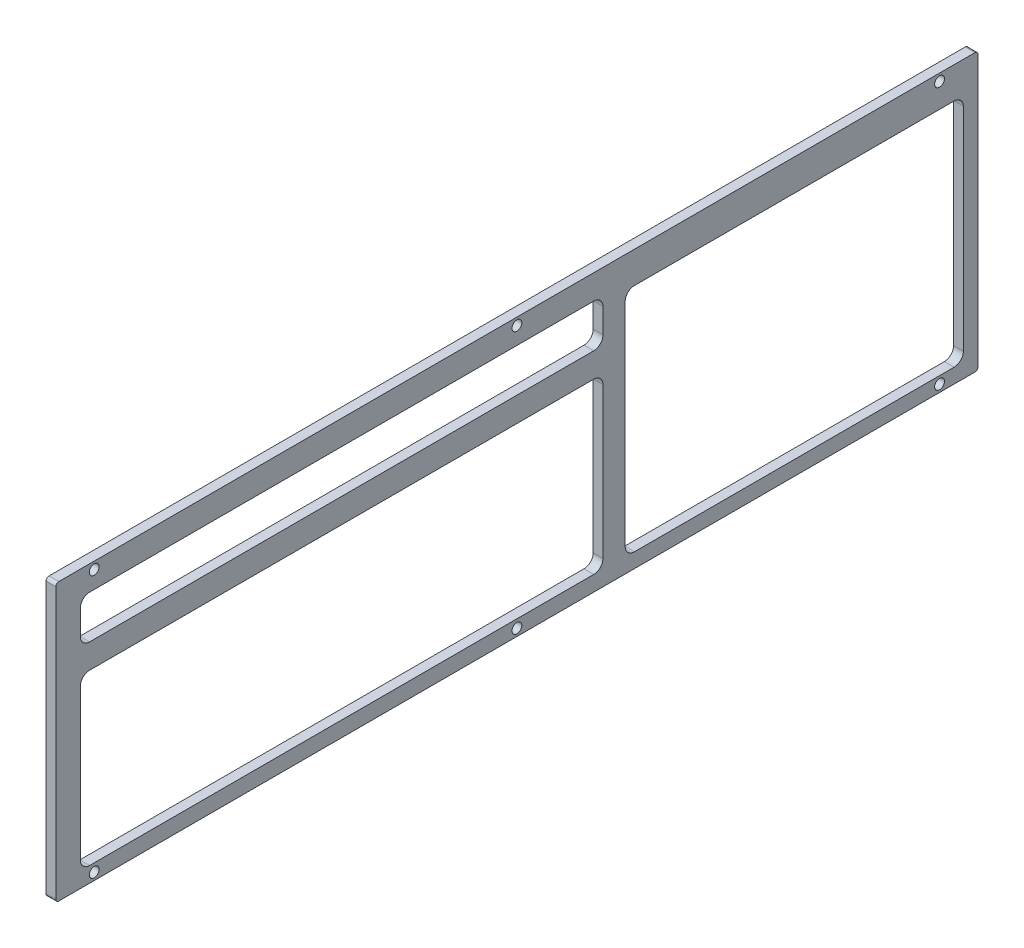
from build123d import *

# Parameters (mm, degrees)
SKETCH2_W            = 300
SKETCH2_H            = 90
BOSS_EXTRUDE1_DEPTH  = 3.175
SKETCH4_W            = 170
SKETCH4_H            = 55
SKETCH4_W_2          = 110
SKETCH4_H_2          = 75
SKETCH4_H_3          = 14
CUT_EXTRUDE2_DEPTH   = 157.636779286
M3_CLEARANCE_HOLE1_D = 3.2
FILLET1_R            = 3
FILLET2_R            = 1


with BuildPart() as part:
    # Sketch2 → Boss-Extrude1 (new body)
    with BuildSketch(Plane(origin=(0, 0, 0), x_dir=(0, 0, -1), z_dir=(1, 0, 0))):
        Rectangle(SKETCH2_W, SKETCH2_H)
    extrude(amount=BOSS_EXTRUDE1_DEPTH)

    # Sketch4 → Cut-Extrude2 (cut, through all)
    with BuildSketch(Plane(origin=(3.175, 0, 0), x_dir=(0, 0, -1), z_dir=(1, 0, 0))):
        with Locations((-57, -12.5)):
            Rectangle(SKETCH4_W, SKETCH4_H)
        with Locations((90.2375, -2.7375)):
            Rectangle(SKETCH4_W_2, SKETCH4_H_2)
        with Locations((-57, 30)):
            Rectangle(SKETCH4_W, SKETCH4_H_3)
    extrude(amount=-CUT_EXTRUDE2_DEPTH, mode=Mode.SUBTRACT)

    # M3 Clearance Hole1 (through all)
    with Locations(Plane(origin=(3.175, 0, 0), x_dir=(0, 0, -1), z_dir=(1, 0, 0))):
        with Locations((-137.5, 42.61875), (0, 42.61875), (137.5, 42.61875), (137.5, -42.61875), (0, -42.61875), (-137.5, -42.61875)):
            Hole(M3_CLEARANCE_HOLE1_D / 2)

    # Fillet1
    fillet1_edges = [part.edges().sort_by_distance(p)[0] for p in [
        (1.5875, 34.7625, -145.2375),
        (1.5875, -40.2375, -145.2375),
        (1.5875, -40.2375, -35.2375),
        (1.5875, 34.7625, -35.2375),
        (1.5875, -40, 142),
        (1.5875, 15, 142),
        (1.5875, 15, -28),
        (1.5875, -40, -28),
        (1.5875, 23, 142),
        (1.5875, 37, 142),
        (1.5875, 37, -28),
        (1.5875, 23, -28),
    ]]
    fillet(fillet1_edges, radius=FILLET1_R)

    # Fillet2
    fillet2_edges = [part.edges().sort_by_distance(p)[0] for p in [
        (1.5875, -45, -150),
        (1.5875, -45, 150),
        (1.5875, 45, 150),
        (1.5875, 45, -150),
    ]]
    fillet(fillet2_edges, radius=FILLET2_R)


solid = part.part
